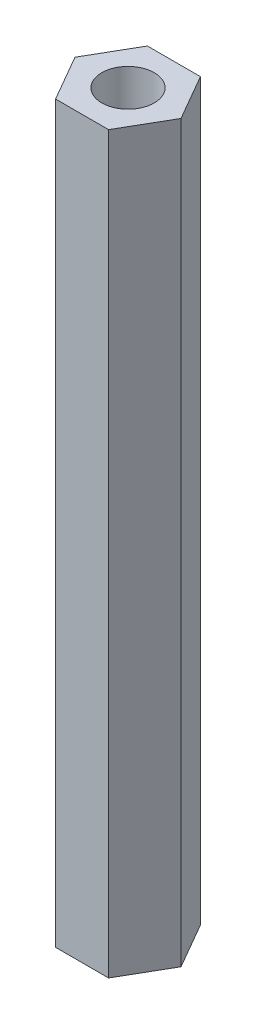
from build123d import *

# Parameters (mm, degrees)
SKETCH1_R           = 2
BOSS_EXTRUDE1_DEPTH = 56


with BuildPart() as part:
    # Sketch1 → Boss-Extrude1 (new body)
    with BuildSketch(Plane(origin=(0, 0, 0), x_dir=(1, 0, 0), z_dir=(0, 1, 0))):
        Polygon((2.020725942, 3.5), (-2.020725942, 3.5), (-4.041451884, 0), (-2.020725942, -3.5), (2.020725942, -3.5), (4.041451884, 0), align=None)
        with Locations(Location((0, 0, 0), (0, 0, 270))):
            Circle(SKETCH1_R, mode=Mode.SUBTRACT)
    extrude(amount=BOSS_EXTRUDE1_DEPTH)


solid = part.part
